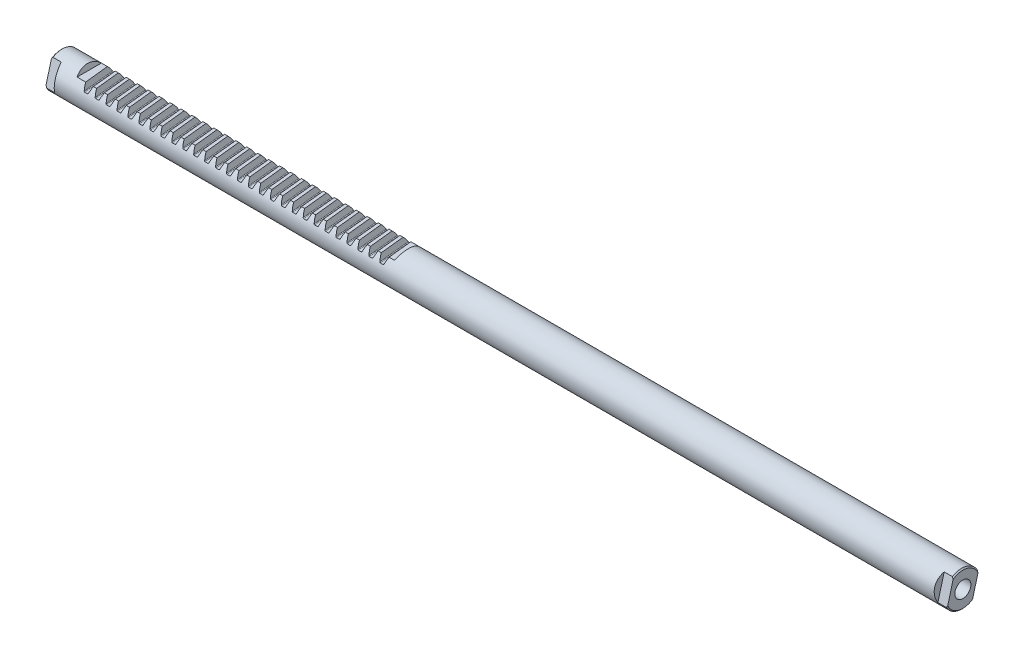
from build123d import *

# Parameters (mm, degrees)
ENL_V_MAT_EXTRU_1_DEPTH    = 12.5
ENL_V_MAT_EXTRU_2_DEPTH    = 12.5
R_P_TITION_LIN_AIRE2_COUNT = 28
R_P_TITION_LIN_AIRE2_PITCH = 6.8
ENL_V_MAT_EXTRU_3_DEPTH    = 12.5


with BuildPart() as part:
    # Esquisse1 → Base-Révolution (revolve)
    with BuildSketch(Plane.XY, mode=Mode.PRIVATE) as base_r_volution_sk:
        Polygon((-257.113248654, 0), (257.113248654, 0), (260, 5), (280, 5), (280, 10.292893219), (279.292893219, 11), (-279.292893219, 11), (-280, 10.292893219), (-280, 5), (-260, 5), align=None)
    revolve(base_r_volution_sk.sketch.rotate(Axis((301, 0, 0), (-1, 0, 0)), 61.658241773), axis=Axis((301, 0, 0), (-1, 0, 0)))

    # Esquisse2 → Enlèv. mat.-Extru.1 (cut, symmetric)
    with BuildSketch(Plane.XY):
        Polygon((-262.544119063, 8), (-65.455880937, 8), (-64, 12), (-264, 12), align=None)
    extrude(amount=ENL_V_MAT_EXTRU_1_DEPTH, both=True, mode=Mode.SUBTRACT)

    # Esquisse4 → Enlèv. mat.-Extru.2 (cut, symmetric)
    with BuildSketch(Plane(origin=(-514.586649005, 0, 26.968343523), x_dir=(-0.9945218953682734, 0, 0.10452846326765228), z_dir=(-0.10452846326765229, 0, -0.9945218953682734))):
        with BuildLine():
            Line((-262.8, 8), (-261.691343001, 4.953989928))
            ThreePointArc((-261.691343001, 4.953989928), (-261.508284908, 4.715423978), (-261.22149669, 4.625))
            Line((-261.22149669, 4.625), (-259.57850331, 4.625))
            ThreePointArc((-259.57850331, 4.625), (-259.291715092, 4.715423978), (-259.108656999, 4.953989928))
            Line((-259.108656999, 4.953989928), (-258, 8))
            Line((-258, 8), (-262.8, 8))
        make_face()
    enl_v_mat_extru_2 = extrude(amount=ENL_V_MAT_EXTRU_2_DEPTH, both=True, mode=Mode.SUBTRACT)

    # Répétition linéaire2: Enlèv. mat.-Extru.2 ×28
    with Locations(*[(i * R_P_TITION_LIN_AIRE2_PITCH, 0, 0) for i in range(1, R_P_TITION_LIN_AIRE2_COUNT)]):
        add(enl_v_mat_extru_2, mode=Mode.SUBTRACT)

    # Esquisse6 → Enlèv. mat.-Extru.3 (cut, symmetric)
    with BuildSketch(Plane(origin=(0, 0, 0), x_dir=(-1, 0, 0), z_dir=(0, 0.9659258262890673, -0.2588190451025247))):
        Polygon((-283, 8), (-274.183821406, 8), (-272, 14), (-283, 14), align=None)
        Polygon((274.183821406, 8), (272, 14), (283, 14), (283, 8), align=None)
        Polygon((-283, -14), (-283, -8), (-274.183821406, -8), (-272, -14), align=None)
        Polygon((274.183821406, -8), (272, -14), (283, -14), (283, -8), align=None)
    extrude(amount=ENL_V_MAT_EXTRU_3_DEPTH, both=True, mode=Mode.SUBTRACT)


solid = part.part
